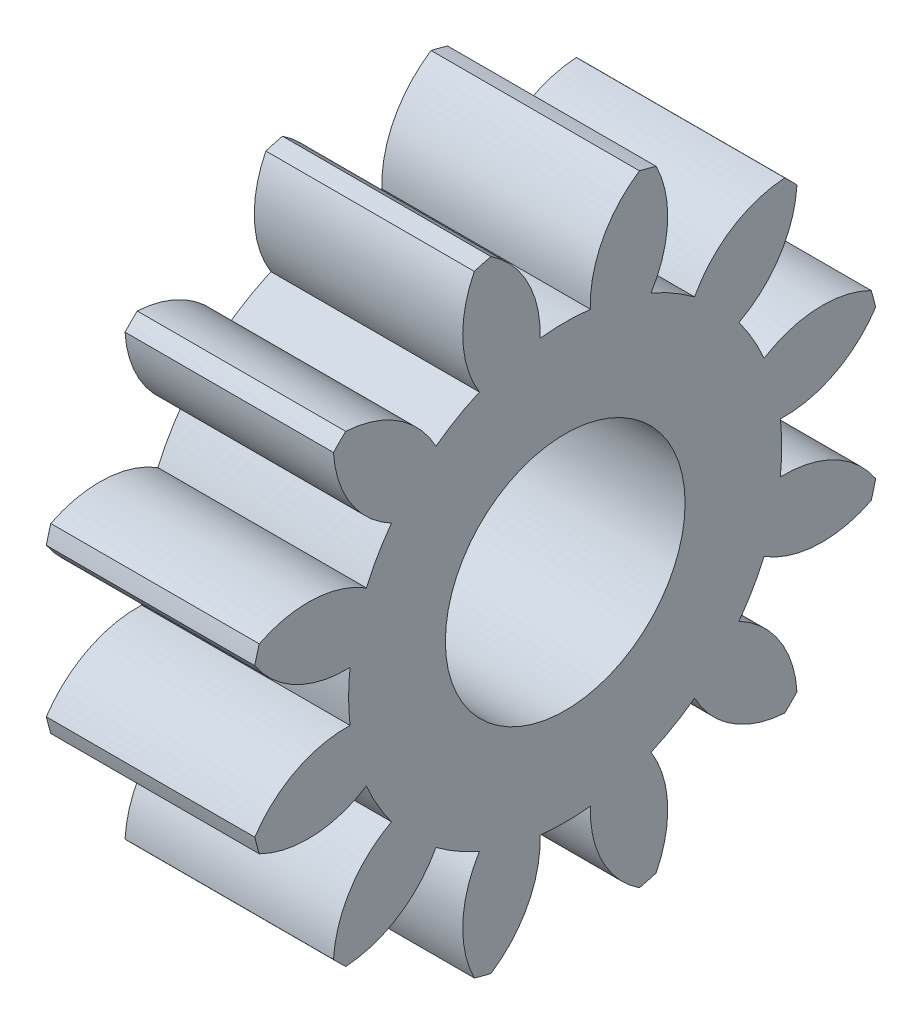
from build123d import *
from build123d.topology import SkipClean

# Parameters (mm, degrees)
BASPROSKE_W             = 8
BASPROSKE_H             = 12.25
TOOTHCUT_DEPTH          = 20.082059637
TEETHCUTS_COUNT         = 12
TEETHCUTS_ANGLE         = 330
HUBNEARONE_START        = 8.0000508
HUBNEAONESKE_R          = 8.3115
HUBNEARONE_DEPTH        = 8.0000508
BORSKE_R                = 4.5
BORE_DEPTH              = 16.0000508
ESQUISSE1_R             = 8.3115
ENL_V_MAT_EXTRU_1_DEPTH = 8
ESQUISSE2_R             = 4.5
ESQUISSE2_R_2           = 4.275
BOSS_EXTRU_1_DEPTH      = 8
ESQUISSE3_R             = 4.6
ENL_V_MAT_EXTRU_2_DEPTH = 10


with BuildPart() as part:
    # BasProSke → Base-Revolve (revolve)
    with BuildSketch(Plane(origin=(0, 0, 0), x_dir=(1, 0, 0), z_dir=(0, 1, 0)), mode=Mode.PRIVATE) as base_revolve_sk:
        with Locations((4, 6.125)):
            Rectangle(BASPROSKE_W, BASPROSKE_H)
    revolve(base_revolve_sk.sketch.rotate(Axis((-10, 0, 0), (1, 0, 0)), 180), axis=Axis((-10, 0, 0), (1, 0, 0)))

    # TooCutSke → ToothCut (cut, through all)
    with BuildSketch(Plane(origin=(0, 0, 0), x_dir=(0, 0, -1), z_dir=(1, 0, 0))):
        with BuildLine():
            ThreePointArc((0.965128363, 8.255274647), (0, 8.3115), (-0.965128363, 8.255274647))
            ThreePointArc((-0.965128363, 8.255274647), (-1.43628674, 10.346733197), (-2.878284339, 11.933185846))
            ThreePointArc((-2.878284339, 11.933185846), (0, 12.2754), (2.878284339, 11.933185846))
            ThreePointArc((2.878284339, 11.933185846), (1.43628674, 10.346733197), (0.965128363, 8.255274647))
        make_face()
    toothcut = extrude(amount=TOOTHCUT_DEPTH, mode=Mode.SUBTRACT)

    # TeethCuts: ToothCut ×12 about axis
    teethcuts_axis = Axis((-10, 0, 0), (1, 0, 0))
    for i in range(1, TEETHCUTS_COUNT):
        add(toothcut.rotate(teethcuts_axis, i * TEETHCUTS_ANGLE / (TEETHCUTS_COUNT - 1)), mode=Mode.SUBTRACT)

    # HubNeaOneSke → HubNearOne (add)
    with SkipClean():  # the faces are left unmerged after this step: merging them gives an invalid solid
        with BuildSketch(Plane.ZY.offset(HUBNEARONE_START)):
            Circle(HUBNEAONESKE_R)
        extrude(amount=-HUBNEARONE_DEPTH)

    # BorSke → Bore (cut, symmetric)
    with SkipClean():  # the faces are left unmerged after this step: merging them gives an invalid solid
        with BuildSketch(Plane(origin=(0, 0, 0), x_dir=(0, 0, -1), z_dir=(1, 0, 0))):
            with Locations(Location((0, 0, 0), (0, 0, 180))):
                Circle(BORSKE_R)
        extrude(amount=BORE_DEPTH, both=True, mode=Mode.SUBTRACT)

    # Esquisse1 → Enlèv. mat.-Extru.1 (cut)
    with SkipClean():  # the faces are left unmerged after this step: merging them gives an invalid solid
        with BuildSketch(Plane.ZY.offset(8.0000508)):
            Circle(ESQUISSE1_R)
        extrude(amount=-ENL_V_MAT_EXTRU_1_DEPTH, mode=Mode.SUBTRACT)

    # Esquisse2 → Boss.-Extru.1 (add)
    with SkipClean():  # the faces are left unmerged after this step: merging them gives an invalid solid
        with BuildSketch(Plane(origin=(8, 0, 0), x_dir=(0, 0, -1), z_dir=(1, 0, 0))):
            with Locations(Location((0, 0, 0), (0, 0, 180))):
                Circle(ESQUISSE2_R)
            Circle(ESQUISSE2_R_2, mode=Mode.SUBTRACT)
        extrude(amount=-BOSS_EXTRU_1_DEPTH)

    # Esquisse3 → Enlèv. mat.-Extru.2 (cut)
    with SkipClean():  # the faces are left unmerged after this step: merging them gives an invalid solid
        with BuildSketch(Plane.ZY.offset(5.08e-05)):
            Circle(ESQUISSE3_R)
        extrude(amount=-ENL_V_MAT_EXTRU_2_DEPTH, mode=Mode.SUBTRACT)


solid = part.part
